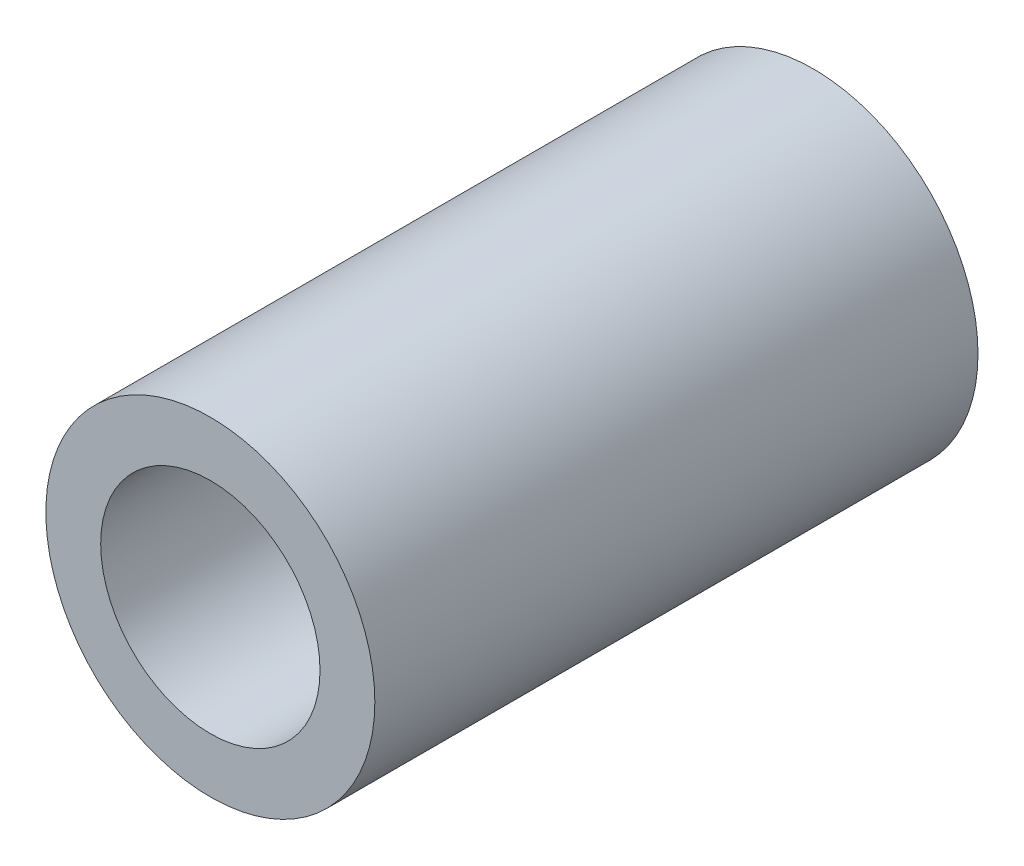
from build123d import *

# Parameters (mm, degrees)
BEARINGSKE_R   = 1.5
BEARINGSKE_R_2 = 1
BEARING_DEPTH  = 5.5


with BuildPart() as part:
    # BearingSke → Bearing (new body)
    with BuildSketch(Plane.XY):
        Circle(BEARINGSKE_R)
        Circle(BEARINGSKE_R_2, mode=Mode.SUBTRACT)
    extrude(amount=BEARING_DEPTH)


solid = part.part
